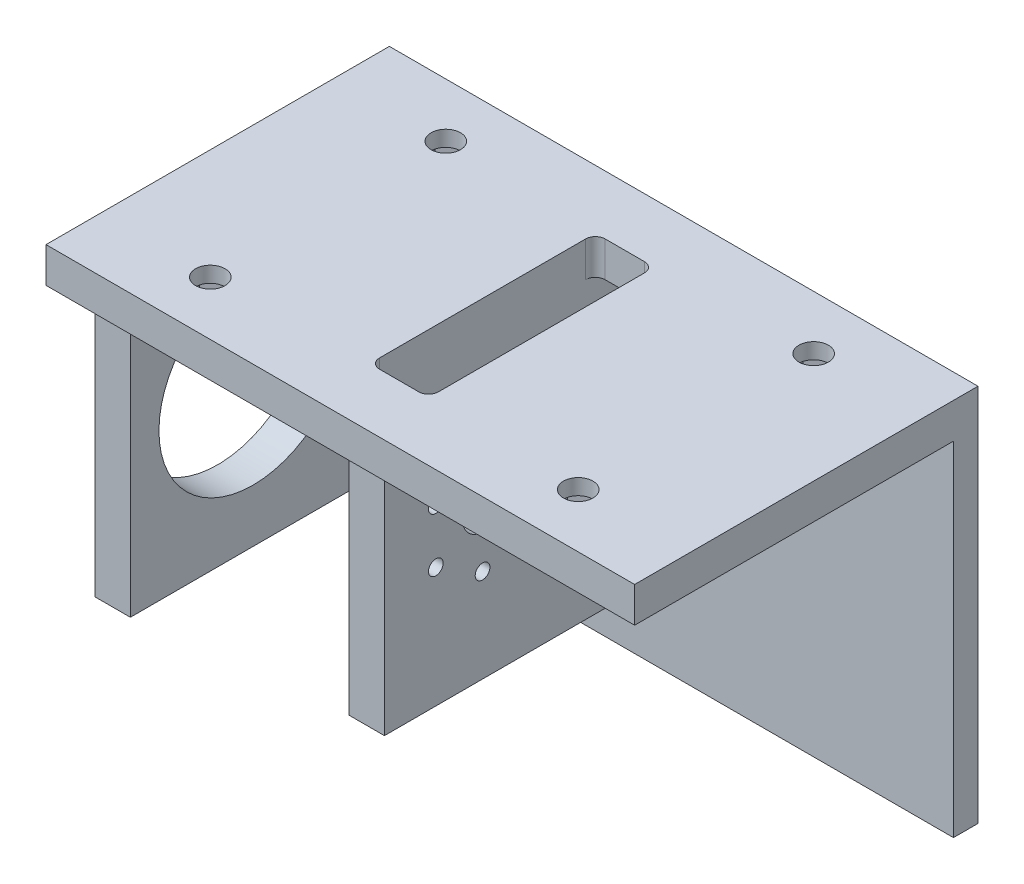
from build123d import *

# Parameters (mm, degrees)
SKETCH1_W           = 120
SKETCH1_H           = 70
SKETCH1_R           = 3
SKETCH1_W_2         = 12
SKETCH1_H_2         = 46
BOSS_EXTRUDE1_DEPTH = 7.2
FILLET1_R           = 2
SKETCH2_W           = 120
SKETCH2_H           = 5
BOSS_EXTRUDE2_DEPTH = 70
SKETCH3_W           = 7.2
SKETCH3_H           = 60
BOSS_EXTRUDE3_DEPTH = 50
SKETCH4_R           = 4
SKETCH4_R_2         = 1.5
CUT_EXTRUDE1_DEPTH  = 10
SKETCH5_R           = 8.5
CUT_EXTRUDE2_DEPTH  = 3
SKETCH6_W           = 7.2
SKETCH6_H           = 60
BOSS_EXTRUDE4_DEPTH = 55
CUT_EXTRUDE4_DEPTH  = 4
CUT_EXTRUDE5_START  = -60
SKETCH10_R          = 4
CUT_EXTRUDE5_DEPTH  = 60
SKETCH11_R          = 19.175
CUT_EXTRUDE6_DEPTH  = 7.2


with BuildPart() as part:
    # Sketch1 → Boss-Extrude1 (new body)
    with BuildSketch(Plane(origin=(0, 0, 0), x_dir=(1, 0, 0), z_dir=(0, 1, 0))):
        Rectangle(SKETCH1_W, SKETCH1_H)
        with Locations(Location((-37.5, 24, 0), (0, 0, 270))):
            Circle(SKETCH1_R, mode=Mode.SUBTRACT)
        with Locations(Location((-37.5, -24, 0), (0, 0, 90))):
            Circle(SKETCH1_R, mode=Mode.SUBTRACT)
        with Locations(Location((37.5, 24, 0), (0, 0, 90))):
            Circle(SKETCH1_R, mode=Mode.SUBTRACT)
        with Locations(Location((37.5, -24, 0), (0, 0, 270))):
            Circle(SKETCH1_R, mode=Mode.SUBTRACT)
        Rectangle(SKETCH1_W_2, SKETCH1_H_2, mode=Mode.SUBTRACT)
    extrude(amount=BOSS_EXTRUDE1_DEPTH)

    # Fillet1
    fillet1_edges = [part.edges().sort_by_distance(p)[0] for p in [
        (-6, 3.6, -23),
        (-6, 3.6, 23),
        (6, 3.6, 23),
        (6, 3.6, -23),
    ]]
    fillet(fillet1_edges, radius=FILLET1_R)

    # Sketch2 → Boss-Extrude2 (add)
    with BuildSketch(Plane.XZ):
        with Locations((0, -32.5)):
            Rectangle(SKETCH2_W, SKETCH2_H)
    extrude(amount=BOSS_EXTRUDE2_DEPTH)

    # Sketch3 → Boss-Extrude3 (add)
    with BuildSketch(Plane.XY.offset(-30)):
        with Locations((-9.6, -30)):
            Rectangle(SKETCH3_W, SKETCH3_H)
    extrude(amount=BOSS_EXTRUDE3_DEPTH)

    # Sketch4 → Cut-Extrude1 (cut)
    with BuildSketch(Plane.ZY.offset(13.2)):
        with Locations((0, -30)):
            Circle(SKETCH4_R)
        with Locations((0, -19)):
            Circle(SKETCH4_R_2)
        with Locations((-9.526279442, -24.5)):
            Circle(SKETCH4_R_2)
        with Locations((-9.526279442, -35.5)):
            Circle(SKETCH4_R_2)
        with Locations((0, -41)):
            Circle(SKETCH4_R_2)
        with Locations((9.526279442, -35.5)):
            Circle(SKETCH4_R_2)
        with Locations((9.526279442, -24.5)):
            Circle(SKETCH4_R_2)
    extrude(amount=-CUT_EXTRUDE1_DEPTH, mode=Mode.SUBTRACT)

    # Sketch5 → Cut-Extrude2 (cut)
    with BuildSketch(Plane.ZY.offset(13.2)):
        with Locations((0, -30)):
            Circle(SKETCH5_R)
    extrude(amount=-CUT_EXTRUDE2_DEPTH, mode=Mode.SUBTRACT)

    # Sketch6 → Boss-Extrude4 (add)
    with BuildSketch(Plane.XY.offset(-30)):
        with Locations((-56.4, -30)):
            Rectangle(SKETCH6_W, SKETCH6_H)
    extrude(amount=BOSS_EXTRUDE4_DEPTH)

    # Sketch8 → Cut-Extrude4 (cut)
    with BuildSketch(Plane.XZ):
        Polygon((42.7, 27.0022214), (37.5, 30.0044428), (32.3, 27.0022214), (32.3, 20.9977786), (37.5, 17.9955572), (42.7, 20.9977786), align=None)
        Polygon((-32.3, 27.0022214), (-37.5, 30.0044428), (-42.7, 27.0022214), (-42.7, 20.9977786), (-37.5, 17.9955572), (-32.3, 20.9977786), align=None)
        Polygon((42.7, -20.9977786), (37.5, -17.9955572), (32.3, -20.9977786), (32.3, -27.0022214), (37.5, -30.0044428), (42.7, -27.0022214), align=None)
        Polygon((-32.3, -20.9977786), (-37.5, -17.9955572), (-42.7, -20.9977786), (-42.7, -27.0022214), (-37.5, -30.0044428), (-32.3, -27.0022214), align=None)
    extrude(amount=-CUT_EXTRUDE4_DEPTH, mode=Mode.SUBTRACT)

    # Sketch10 → Cut-Extrude5 (cut)
    with BuildSketch(Plane(origin=(-6, 0, 0), x_dir=(0, 0, -1), z_dir=(1, 0, 0)).offset(CUT_EXTRUDE5_START)):
        with Locations(Location((0, -30, 0), (0, 0, 180))):
            Circle(SKETCH10_R)
    extrude(amount=CUT_EXTRUDE5_DEPTH, mode=Mode.SUBTRACT)

    # Sketch11 → Cut-Extrude6 (cut)
    with BuildSketch(Plane.ZY.offset(60)):
        with Locations((0, -30)):
            Circle(SKETCH11_R)
    extrude(amount=-CUT_EXTRUDE6_DEPTH, mode=Mode.SUBTRACT)


solid = part.part
